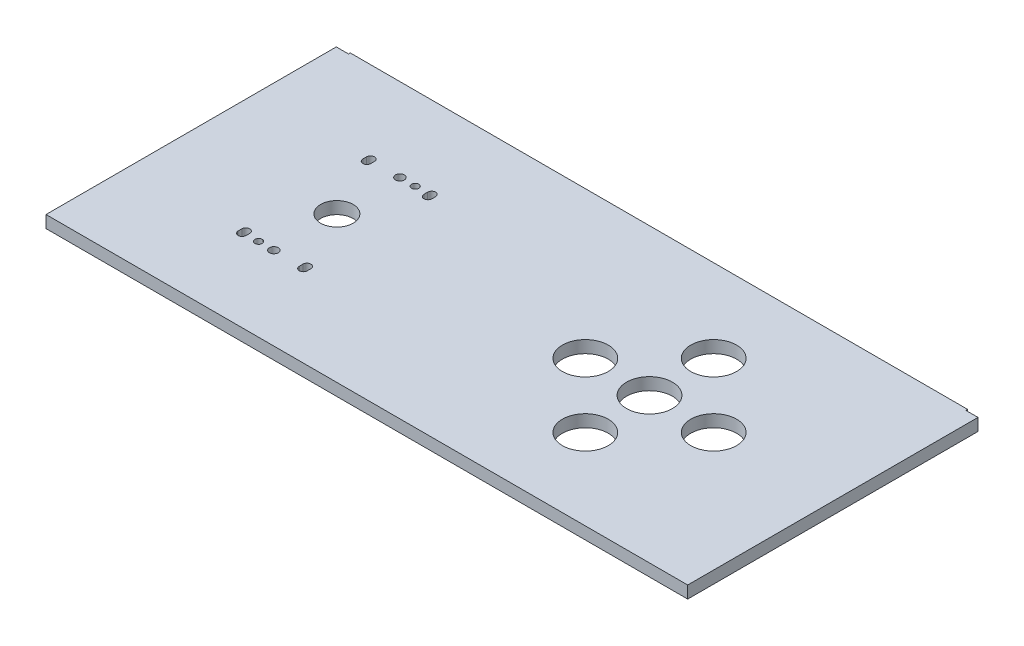
from build123d import *

# Parameters (mm, degrees)
SKETCH1_R           = 15
SKETCH1_R_2         = 2.375
SKETCH1_R_3         = 2.9
SKETCH1_R_4         = 10.65
BOSS_EXTRUDE1_DEPTH = 8


with BuildPart() as part:
    # Sketch1 → Boss-Extrude1 (new body)
    with BuildSketch(Plane(origin=(0, 0, 0), x_dir=(1, 0, 0), z_dir=(0, 1, 0))):
        Polygon((8, 191.154701829), (8, 190), (0, 190), (0, 0), (420, 0), (420, 190), (412, 190), (412, 191.154701829), align=None)
        with Locations(Location((300, 137, 0), (0, 0, 270))):
            Circle(SKETCH1_R, mode=Mode.SUBTRACT)
        with Locations(Location((300, 53, 0), (0, 0, 270))):
            Circle(SKETCH1_R, mode=Mode.SUBTRACT)
        with Locations(Location((258, 95, 0), (0, 0, 270))):
            Circle(SKETCH1_R, mode=Mode.SUBTRACT)
        with Locations(Location((300, 95, 0), (0, 0, 270))):
            Circle(SKETCH1_R, mode=Mode.SUBTRACT)
        with Locations(Location((342, 95, 0), (0, 0, 270))):
            Circle(SKETCH1_R, mode=Mode.SUBTRACT)
        with BuildLine():
            Line((112.209434277, 135.177360592), (112.209434277, 137.577360592))
            ThreePointArc((112.209434277, 137.577360592), (114.809434277, 140.177360592), (117.409434277, 137.577360592))
            Line((117.409434277, 137.577360592), (117.409434277, 135.177360592))
            ThreePointArc((117.409434277, 135.177360592), (114.809434277, 132.577360592), (112.209434277, 135.177360592))
        make_face(mode=Mode.SUBTRACT)
        with Locations(Location((104.809434277, 136.82735285, 0), (0, 0, 270))):
            Circle(SKETCH1_R_2, mode=Mode.SUBTRACT)
        with BuildLine():
            Line((72.209434277, 53.577360592), (72.209434277, 55.977360592))
            ThreePointArc((72.209434277, 55.977360592), (74.809434277, 58.577360592), (77.409434277, 55.977360592))
            Line((77.409434277, 55.977360592), (77.409434277, 53.577360592))
            ThreePointArc((77.409434277, 53.577360592), (74.809434277, 50.977360592), (72.209434277, 53.577360592))
        make_face(mode=Mode.SUBTRACT)
        with Locations(Location((84.809434277, 54.327360592, 0), (0, 0, 270))):
            Circle(SKETCH1_R_2, mode=Mode.SUBTRACT)
        with Locations(Location((94.809434277, 54.327360592, 0), (0, 0, 270))):
            Circle(SKETCH1_R_3, mode=Mode.SUBTRACT)
        with BuildLine():
            Line((112.209434277, 53.577360592), (112.209434277, 55.977360592))
            ThreePointArc((112.209434277, 55.977360592), (114.809434277, 58.577360592), (117.409434277, 55.977360592))
            Line((117.409434277, 55.977360592), (117.409434277, 53.577360592))
            ThreePointArc((117.409434277, 53.577360592), (114.809434277, 50.977360592), (112.209434277, 53.577360592))
        make_face(mode=Mode.SUBTRACT)
        with Locations(Location((94.809434277, 95.577360592, 0), (0, 0, 270))):
            Circle(SKETCH1_R_4, mode=Mode.SUBTRACT)
        with BuildLine():
            Line((77.409434277, 137.577360592), (77.409434277, 135.177360592))
            ThreePointArc((77.409434277, 135.177360592), (74.809434277, 132.577360592), (72.209434277, 135.177360592))
            Line((72.209434277, 135.177360592), (72.209434277, 137.577360592))
            ThreePointArc((72.209434277, 137.577360592), (74.809434277, 140.177360592), (77.409434277, 137.577360592))
        make_face(mode=Mode.SUBTRACT)
        with Locations(Location((94.809434277, 136.827360592, 0), (0, 0, 270))):
            Circle(SKETCH1_R_3, mode=Mode.SUBTRACT)
    extrude(amount=BOSS_EXTRUDE1_DEPTH)


solid = part.part
